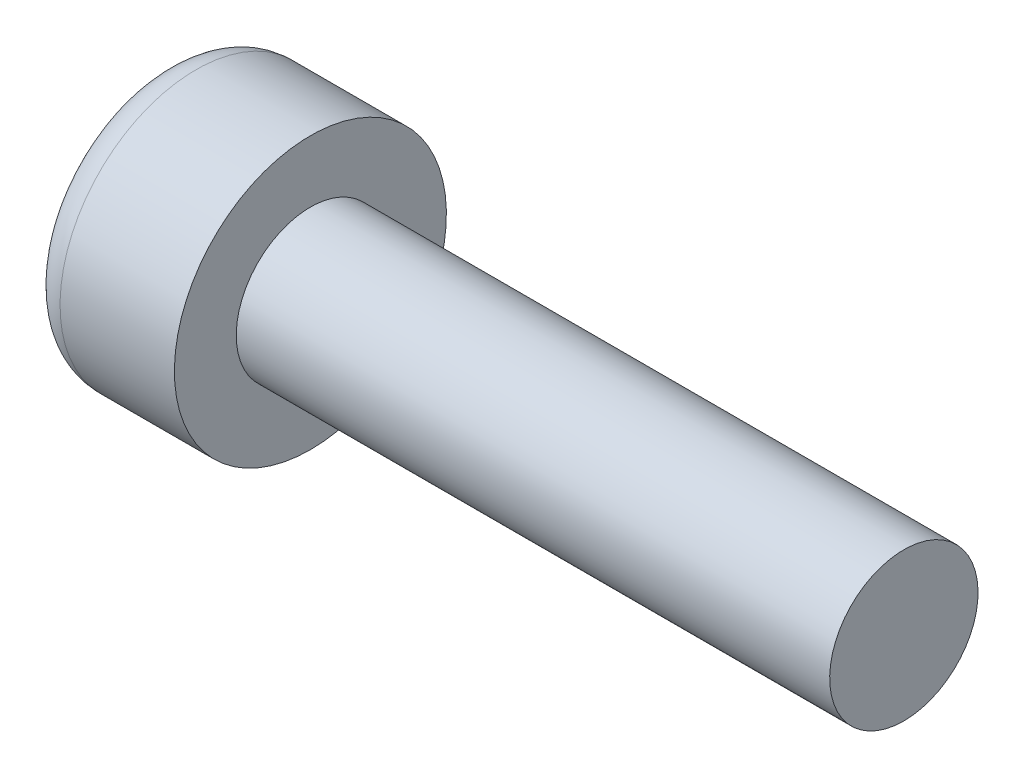
from build123d import *

# Parameters (mm, degrees)
CUT_EXTRUDE1_DEPTH = 1.5


with BuildPart() as part:
    # Sketch1 → Revolve1 (revolve)
    with BuildSketch(Plane.XY, mode=Mode.PRIVATE) as revolve1_sk:
        with BuildLine():
            Line((0, 0), (0, 2.0625))
            ThreePointArc((0, 2.0625), (0.201364088, 2.548635912), (0.6875, 2.75))
            Line((0.6875, 2.75), (3, 2.75))
            Line((3, 2.75), (3, 1.5))
            Line((3, 1.5), (15, 1.5))
            Line((15, 1.5), (15, 0))
            Line((15, 0), (0, 0))
        make_face()
    revolve(revolve1_sk.sketch.rotate(Axis((0, 0, 0), (1, 0, 0)), 180), axis=Axis((0, 0, 0), (1, 0, 0)))

    # Sketch2 → Cut-Extrude1 (cut)
    with BuildSketch(Plane.ZY):
        Polygon((0, 1.443375673), (-1.25, 0.721687836), (-1.25, -0.721687836), (0, -1.443375673), (1.25, -0.721687836), (1.25, 0.721687836), align=None)
    extrude(amount=-CUT_EXTRUDE1_DEPTH, mode=Mode.SUBTRACT)


solid = part.part
